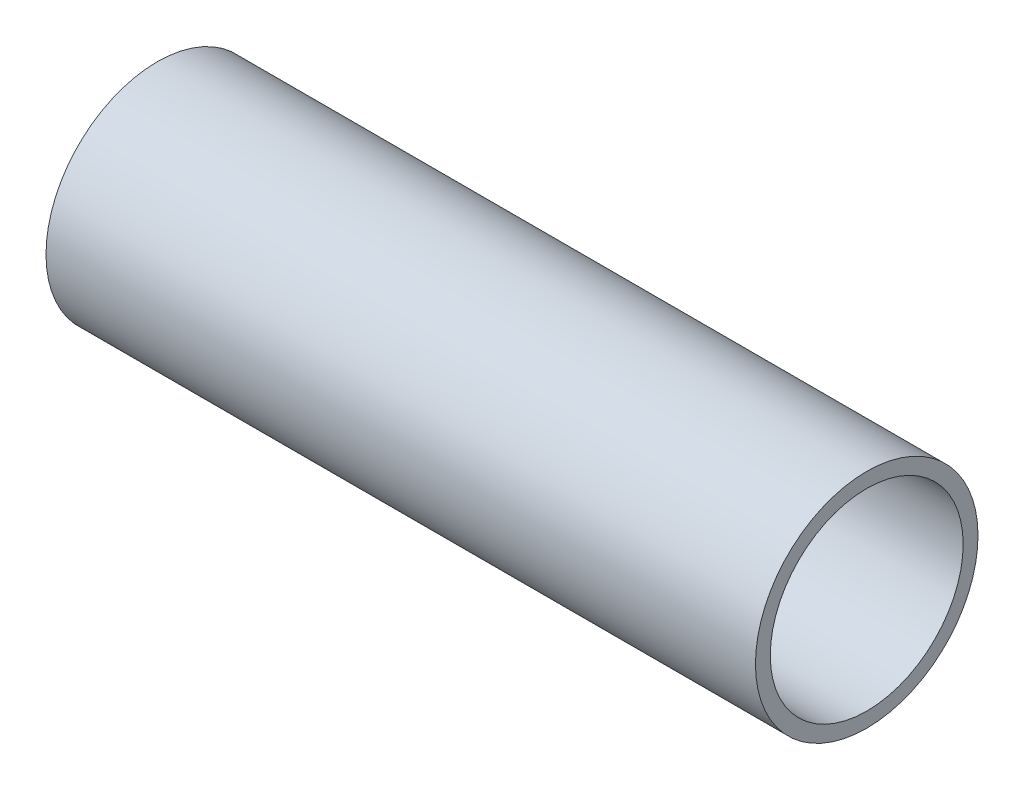
from build123d import *

# Parameters (mm, degrees)
SKETCH_1_R      = 7.5
SKETCH_1_R_2    = 6.5
EXTRUDE_1_DEPTH = 47.82


with BuildPart() as part:
    # 草图1 → 凸台-拉伸1 (new body)
    with BuildSketch(Plane(origin=(0, 0, 0), x_dir=(0, 0, -1), z_dir=(1, 0, 0))):
        Circle(SKETCH_1_R)
        Circle(SKETCH_1_R_2, mode=Mode.SUBTRACT)
    extrude(amount=EXTRUDE_1_DEPTH)


solid = part.part
